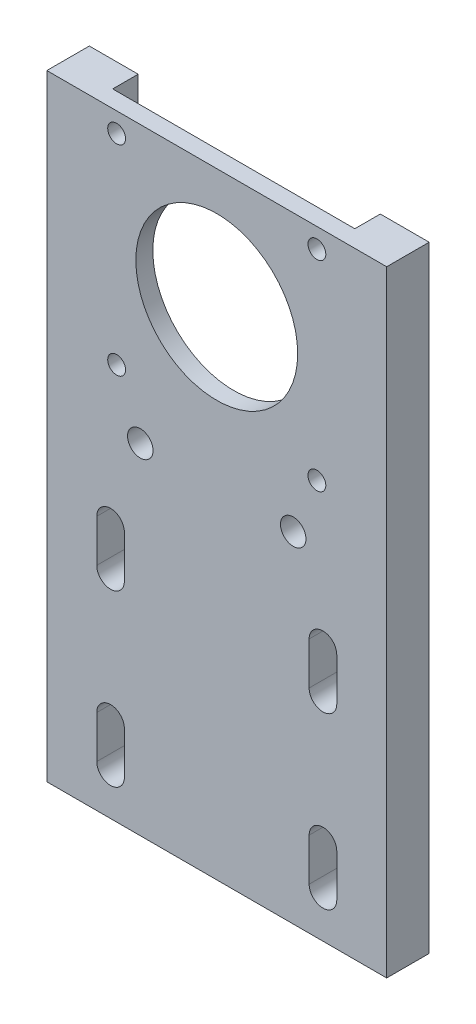
from build123d import *

# Parameters (mm, degrees)
SKETCH_1_W                  = 80
SKETCH_1_H                  = 145
SKETCH_1_R                  = 19.05
EXTRUDE_1_DEPTH             = 10
CUT_EXTRUDE_1_DEPTH         = 6
HOLE_WIZARD_M51_D           = 4.2
HOLE_WIZARD_M51_DEPTH       = 14
HOLE_WIZARD_M51_CSINK_D     = 5.05
HOLE_WIZARD_M51_CSINK_ANGLE = 120
HOLE_WIZARD_M51_TIP         = 1.2618073
SKETCH_5_R                  = 3
CUT_EXTRUDE_2_DEPTH         = 7
HOLE_WIZARD_M41_D           = 4.5
HOLE_WIZARD_M41_CSINK_D     = 9.18
HOLE_WIZARD_M41_CSINK_ANGLE = 90


with BuildPart() as part:
    # Эскиз1 → Бобышка-Вытянуть1 (new body)
    with BuildSketch(Plane.XY):
        with Locations((40, 72.5)):
            Rectangle(SKETCH_1_W, SKETCH_1_H)
        with Locations((40, 116.8)):
            Circle(SKETCH_1_R, mode=Mode.SUBTRACT)
        with BuildLine():
            Line((18.25, 60), (18.25, 50))
            ThreePointArc((18.25, 50), (15, 46.75), (11.75, 50))
            Line((11.75, 50), (11.75, 60))
            ThreePointArc((11.75, 60), (15, 63.25), (18.25, 60))
        make_face(mode=Mode.SUBTRACT)
        with BuildLine():
            Line((18.25, 20), (18.25, 10))
            ThreePointArc((18.25, 10), (15, 6.75), (11.75, 10))
            Line((11.75, 10), (11.75, 20))
            ThreePointArc((11.75, 20), (15, 23.25), (18.25, 20))
        make_face(mode=Mode.SUBTRACT)
        with BuildLine():
            Line((61.75, 20), (61.75, 10))
            ThreePointArc((61.75, 10), (65, 6.75), (68.25, 10))
            Line((68.25, 10), (68.25, 20))
            ThreePointArc((68.25, 20), (65, 23.25), (61.75, 20))
        make_face(mode=Mode.SUBTRACT)
        with BuildLine():
            Line((61.75, 60), (61.75, 50))
            ThreePointArc((61.75, 50), (65, 46.75), (68.25, 50))
            Line((68.25, 50), (68.25, 60))
            ThreePointArc((68.25, 60), (65, 63.25), (61.75, 60))
        make_face(mode=Mode.SUBTRACT)
    extrude(amount=EXTRUDE_1_DEPTH)

    # Эскиз4 → Вырез-Вытянуть1 (cut)
    with BuildSketch(Plane(origin=(0, 0, 0), x_dir=(-1, 0, 0), z_dir=(0, 0, -1))):
        with BuildLine():
            Line((-68.5, 145), (-11.5, 145))
            Line((-11.5, 145), (-11.5, 90.5))
            ThreePointArc((-11.5, 90.5), (-12.232233047, 88.732233047), (-14, 88))
            Line((-14, 88), (-66, 88))
            ThreePointArc((-66, 88), (-67.767766953, 88.732233047), (-68.5, 90.5))
            Line((-68.5, 90.5), (-68.5, 145))
        make_face()
    extrude(amount=-CUT_EXTRUDE_1_DEPTH, mode=Mode.SUBTRACT)

    # Отверстие обработанное метчиком M51
    with Locations(Plane(origin=(24.344692429, -10.713064845, 6), x_dir=(-1, 0, 0), z_dir=(0, 0, -1))):
        with Locations((7.914692429, 103.943064845), (7.914692429, 151.083064845), (-39.225307571, 151.083064845), (-39.225307571, 103.943064845)):
            CounterSinkHole(HOLE_WIZARD_M51_D / 2, HOLE_WIZARD_M51_CSINK_D / 2, depth=HOLE_WIZARD_M51_DEPTH, counter_sink_angle=HOLE_WIZARD_M51_CSINK_ANGLE)
            with Locations((0, 0, -(HOLE_WIZARD_M51_DEPTH + HOLE_WIZARD_M51_TIP / 2))):  # 118° drill point
                Cone(0, HOLE_WIZARD_M51_D / 2, HOLE_WIZARD_M51_TIP, mode=Mode.SUBTRACT)

    # Эскиз5 → Вырез-Вытянуть2 (cut)
    with BuildSketch(Plane.XY.offset(10)):
        with Locations((22, 80)):
            Circle(SKETCH_5_R)
        with Locations((58, 80)):
            Circle(SKETCH_5_R)
    extrude(amount=-CUT_EXTRUDE_2_DEPTH, mode=Mode.SUBTRACT)

    # Зенковка для винта с потайной головкой и внутренним шестигранником M41 (through all)
    with Locations(Plane(origin=(0, 0, 0), x_dir=(-1, 0, 0), z_dir=(0, 0, -1))):
        with Locations((-22, 80), (-58, 80)):
            CounterSinkHole(HOLE_WIZARD_M41_D / 2, HOLE_WIZARD_M41_CSINK_D / 2, counter_sink_angle=HOLE_WIZARD_M41_CSINK_ANGLE)


solid = part.part
